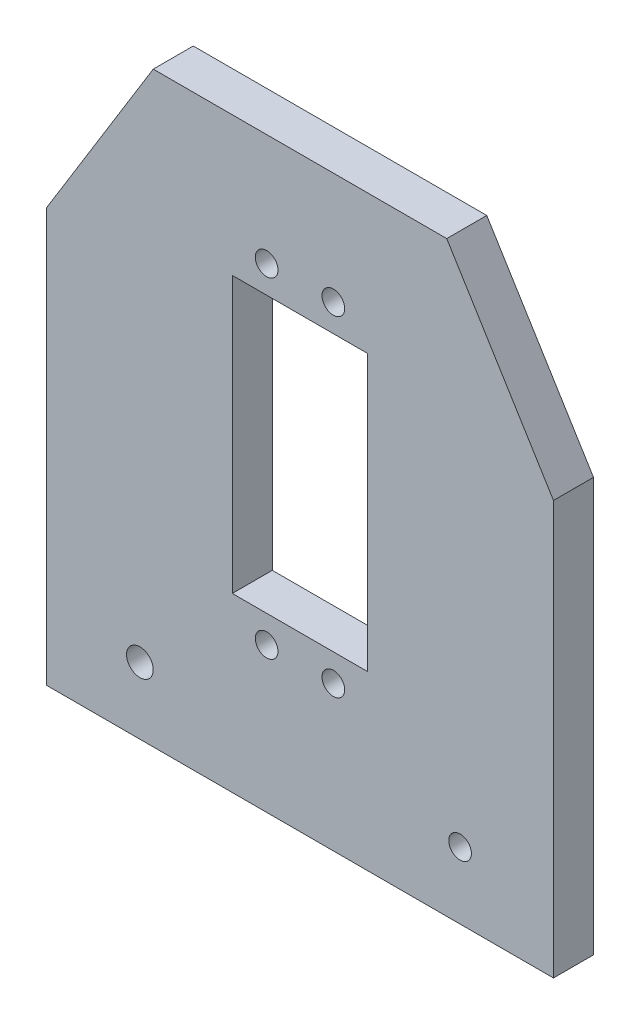
from build123d import *

# Parameters (mm, degrees)
SKETCH_1_R                  = 1.7
SKETCH_1_R_2                = 2
SKETCH_1_W                  = 20.3
SKETCH_1_H                  = 41.3
F_07_TILT_DRIVE_CHEEK_DEPTH = 6


with BuildPart() as part:
    # Эскиз1 → 07_Tilt_drive_cheek (new body)
    with BuildSketch(Plane.XY):
        Polygon((-38, 0), (38, 0), (38, 62), (22, 88), (-22, 88), (-38, 62), align=None)
        with Locations((-5, 21.75)):
            Circle(SKETCH_1_R, mode=Mode.SUBTRACT)
        with Locations((-5, 71.25)):
            Circle(SKETCH_1_R, mode=Mode.SUBTRACT)
        with Locations((5, 21.75)):
            Circle(SKETCH_1_R, mode=Mode.SUBTRACT)
        with Locations((5, 71.25)):
            Circle(SKETCH_1_R, mode=Mode.SUBTRACT)
        with Locations((-24, 10)):
            Circle(SKETCH_1_R_2, mode=Mode.SUBTRACT)
        with Locations((24, 10)):
            Circle(SKETCH_1_R, mode=Mode.SUBTRACT)
        with Locations((0, 46.5)):
            Rectangle(SKETCH_1_W, SKETCH_1_H, mode=Mode.SUBTRACT)
    extrude(amount=F_07_TILT_DRIVE_CHEEK_DEPTH)


solid = part.part
